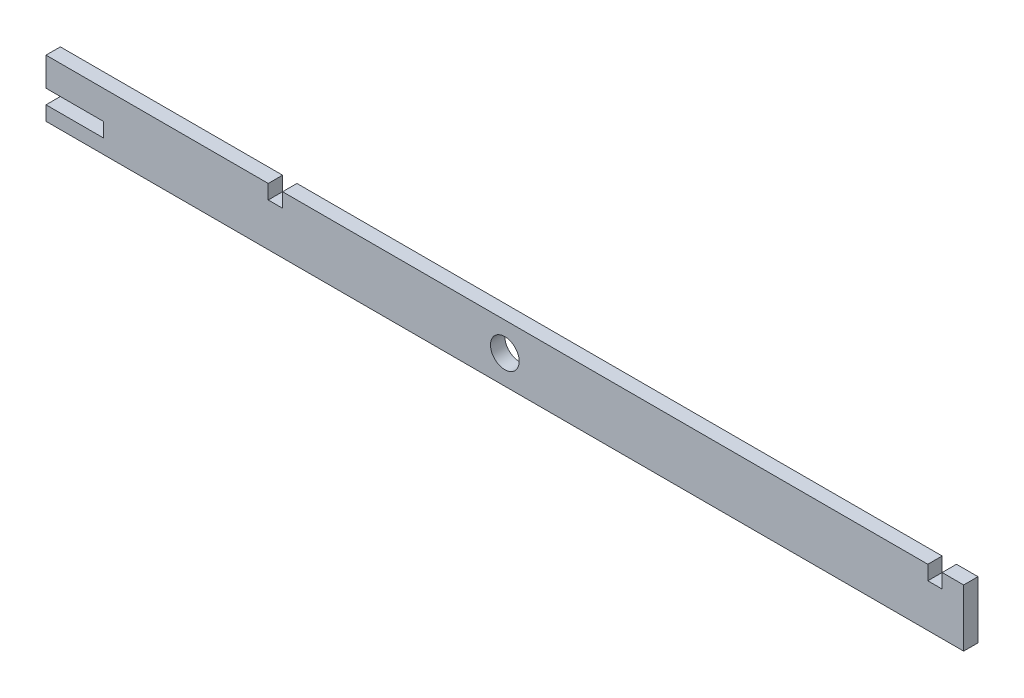
from build123d import *

# Parameters (mm, degrees)
SKETCH2_R           = 3.175
BOSS_EXTRUDE1_DEPTH = 3.175


with BuildPart() as part:
    # Sketch2 → Boss-Extrude1 (new body)
    with BuildSketch(Plane.XY):
        Polygon((0, -12.7), (0, 0), (-4.7625, 0), (-4.7625, -3.175), (-7.9375, -3.175), (-7.9375, 0), (-150.8125, 0), (-150.8125, -3.175), (-153.9875, -3.175), (-153.9875, 0), (-203.2, 0), (-203.2, -6.35), (-190.5, -6.35), (-190.5, -9.525), (-203.2, -9.525), (-203.2, -12.7), align=None)
        with Locations((-101.6, -6.35)):
            Circle(SKETCH2_R, mode=Mode.SUBTRACT)
    extrude(amount=BOSS_EXTRUDE1_DEPTH)


solid = part.part
